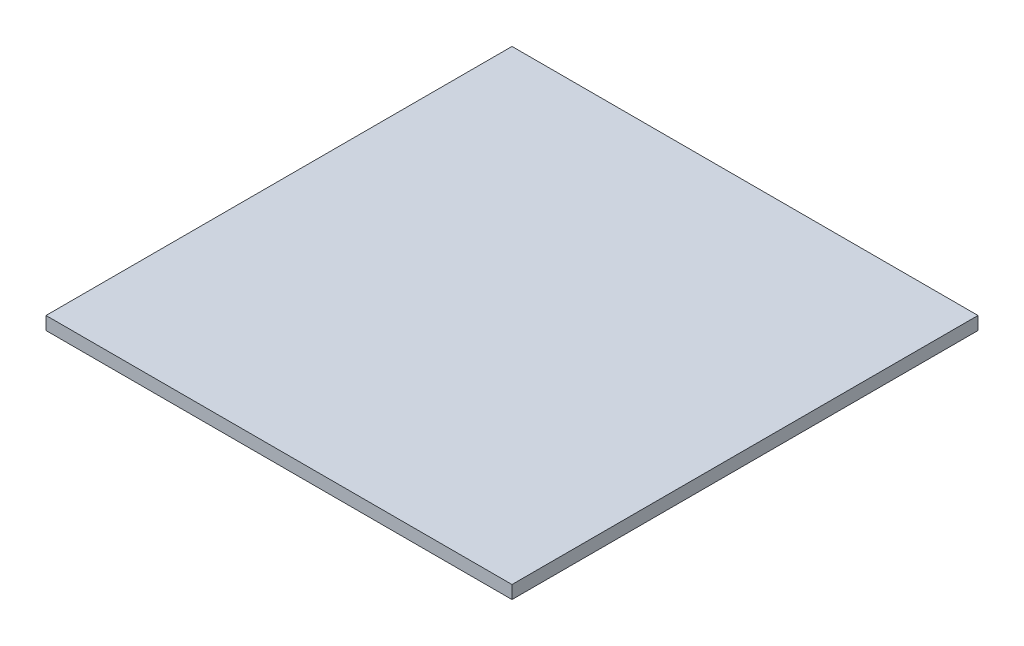
from build123d import *

# Parameters (mm, degrees)
BOSS_EXTRUDE1_DEPTH = 6


with BuildPart() as part:
    # Sketch1 → Boss-Extrude1 (new body)
    with BuildSketch(Plane(origin=(0, 0, 0), x_dir=(1, 0, 0), z_dir=(0, 1, 0))):
        Polygon((-107, 0), (-107, 107), (107, 107), (107, -107), (-107, -107), align=None)
    extrude(amount=BOSS_EXTRUDE1_DEPTH)


solid = part.part
